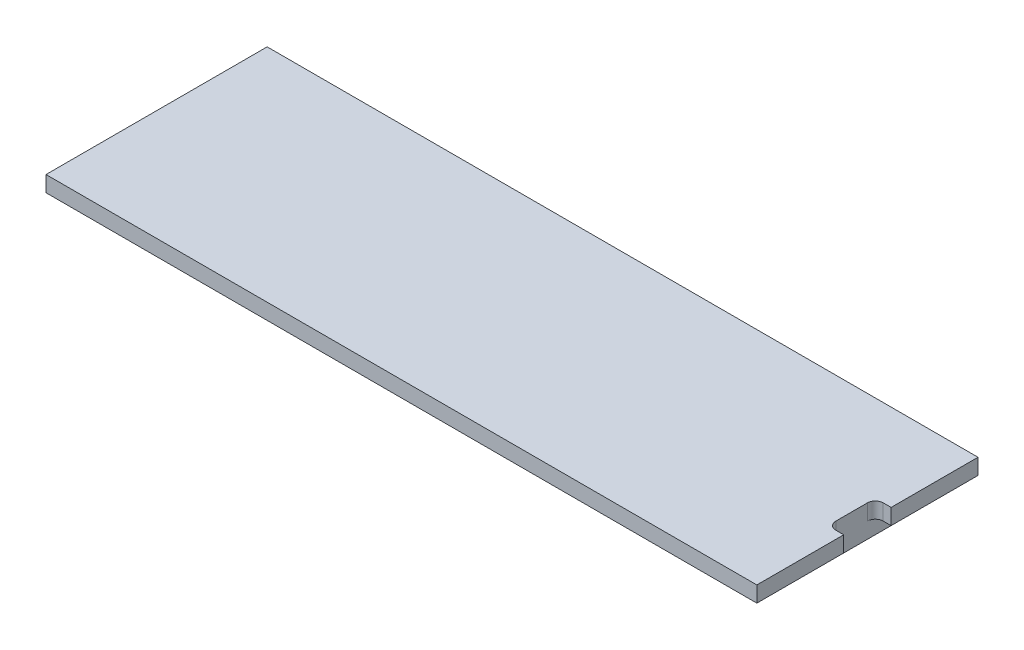
from build123d import *

# Parameters (mm, degrees)
BOSS_EXTRUDE1_DEPTH = 1
SKETCH2_W           = 45
SKETCH2_H           = 14
BOSS_EXTRUDE2_DEPTH = 1
SKETCH3_W           = 1
SKETCH3_H           = 3
CUT_EXTRUDE1_DEPTH  = 1
FILLET1_R           = 0.5


with BuildPart() as part:
    # Sketch1 → Boss-Extrude1 (new body)
    with BuildSketch(Plane(origin=(0, 0, 0), x_dir=(1, 0, 0), z_dir=(0, 1, 0))):
        with BuildLine():
            Line((-20.5, -6), (20.5, -6))
            ThreePointArc((20.5, -6), (21.207106781, -5.707106781), (21.5, -5))
            Line((21.5, -5), (21.5, 5))
            ThreePointArc((21.5, 5), (21.207106781, 5.707106781), (20.5, 6))
            Line((20.5, 6), (-20.5, 6))
            ThreePointArc((-20.5, 6), (-21.207106781, 5.707106781), (-21.5, 5))
            Line((-21.5, 5), (-21.5, -5))
            ThreePointArc((-21.5, -5), (-21.207106781, -5.707106781), (-20.5, -6))
        make_face()
    extrude(amount=BOSS_EXTRUDE1_DEPTH)

    # Sketch2 → Boss-Extrude2 (add)
    with BuildSketch(Plane(origin=(0, 1, 0), x_dir=(1, 0, 0), z_dir=(0, 1, 0))):
        Rectangle(SKETCH2_W, SKETCH2_H)
    extrude(amount=BOSS_EXTRUDE2_DEPTH)

    # Sketch3 → Cut-Extrude1 (cut)
    with BuildSketch(Plane(origin=(0, 2, 0), x_dir=(1, 0, 0), z_dir=(0, 1, 0))):
        with Locations((22, 0)):
            Rectangle(SKETCH3_W, SKETCH3_H)
    extrude(amount=-CUT_EXTRUDE1_DEPTH, mode=Mode.SUBTRACT)

    # Fillet1
    fillet1_edges = [part.edges().sort_by_distance(p)[0] for p in [
        (21.5, 1.5, 1.5),
        (21.5, 1.5, -1.5),
    ]]
    fillet(fillet1_edges, radius=FILLET1_R)


solid = part.part
